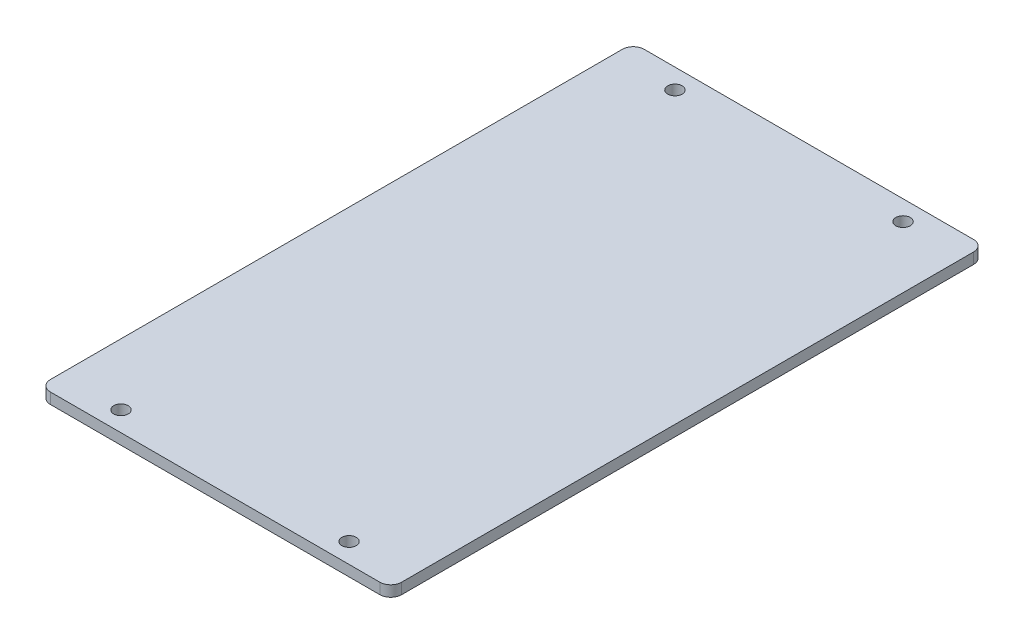
from build123d import *

# Parameters (mm, degrees)
SKETCH2_W           = 97
SKETCH2_H           = 164
SKETCH2_R           = 2
BOSS_EXTRUDE1_DEPTH = 3
FILLET12_R          = 3


with BuildPart() as part:
    # Sketch2 → Boss-Extrude1 (new body)
    with BuildSketch(Plane(origin=(0, 0, 0), x_dir=(1, 0, 0), z_dir=(0, 1, 0))):
        with Locations((46.5, 80)):
            Rectangle(SKETCH2_W, SKETCH2_H)
        with Locations(Location((15, 3.47847595, 0), (0, 0, 270))):
            Circle(SKETCH2_R, mode=Mode.SUBTRACT)
        with Locations(Location((78, 3.47847595, 0), (0, 0, 270))):
            Circle(SKETCH2_R, mode=Mode.SUBTRACT)
        with Locations(Location((15, 156.52152405, 0), (0, 0, 270))):
            Circle(SKETCH2_R, mode=Mode.SUBTRACT)
        with Locations(Location((78, 156.52152405, 0), (0, 0, 270))):
            Circle(SKETCH2_R, mode=Mode.SUBTRACT)
    extrude(amount=BOSS_EXTRUDE1_DEPTH)

    # Fillet12
    fillet12_edges = [part.edges().sort_by_distance(p)[0] for p in [
        (-2, 1.5, -162),
        (95, 1.5, -162),
        (95, 1.5, 2),
        (-2, 1.5, 2),
    ]]
    fillet(fillet12_edges, radius=FILLET12_R)


solid = part.part
